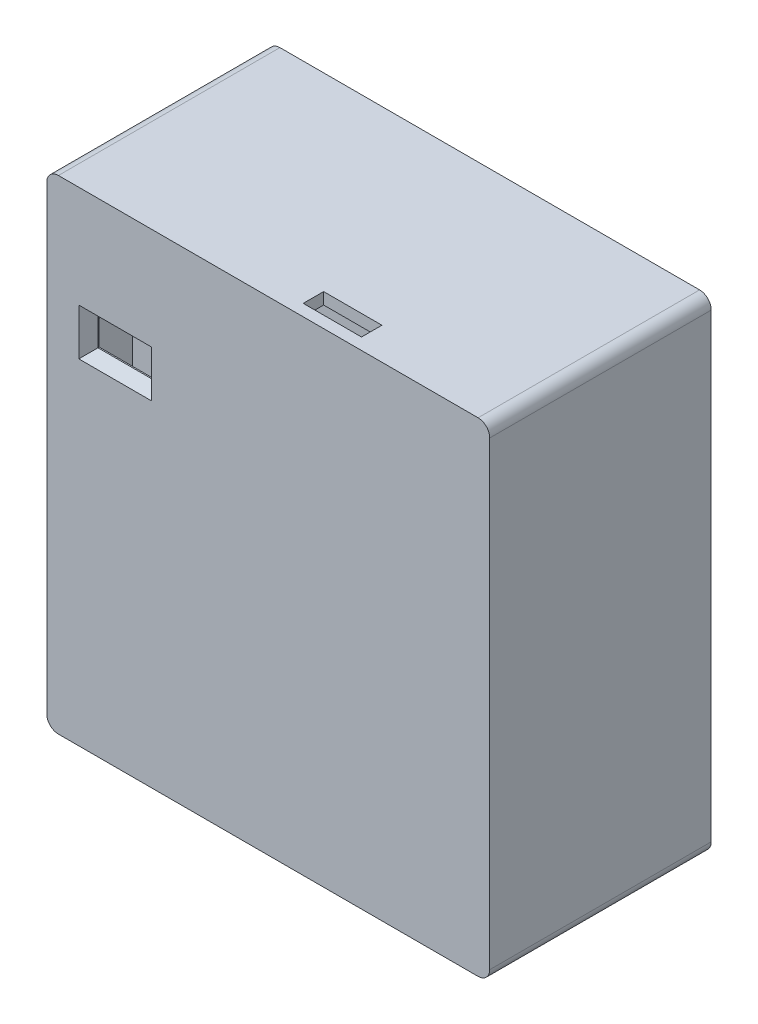
from build123d import *

# Parameters (mm, degrees)
BOSS_EXTRUDE2_DEPTH      = 39.5
BOSS_EXTRUDE2_DEPTH_BACK = 39.5
SKETCH1_W                = 76
SKETCH1_H                = 38
SKETCH1_W_2              = 72
SKETCH1_H_2              = 34
SKETCH2_W                = 76
SKETCH2_H                = 38
BOSS_EXTRUDE3_DEPTH      = 2
BOSS_EXTRUDE4_DEPTH      = 10
BOSS_EXTRUDE4_DEPTH_BACK = 10
SKETCH6_W                = 70
SKETCH6_H                = 70
FILLET1_R                = 2
CUT_EXTRUDE1_DEPTH       = 1
CUT_EXTRUDE1_DEPTH_BACK  = 2.5
SKETCH7_W                = 2
SKETCH7_H                = 10
SKETCH7_W_2              = 10
SKETCH7_H_2              = 2
SKETCH8_R                = 6.5
CUT_EXTRUDE2_DEPTH       = 2
SKETCH9_W                = 20
SKETCH9_H                = 7
SKETCH9_W_2              = 25
SKETCH9_W_3              = 7
SKETCH9_H_2              = 20
BOSS_EXTRUDE5_DEPTH      = 10
SKETCH10_W               = 9.5
SKETCH10_H               = 5
CUT_EXTRUDE3_DEPTH       = 2
CHAMFER1_SIZE            = 1.5
CHAMFER1_SIZE2           = 1.787630389
SKETCH11_W               = 3.7
SKETCH11_H               = 16
SKETCH11_R               = 1.25
SKETCH11_W_2             = 7
SKETCH11_H_2             = 5
BOSS_EXTRUDE10_DEPTH     = 7.3
CUT_EXTRUDE6_DEPTH       = 60.390655831
BOSS_EXTRUDE11_REACH     = 68.8
SKETCH17_R               = 2.75
CUT_EXTRUDE9_DEPTH       = 3


with BuildPart() as part:
    # Sketch1 → Boss-Extrude2 (new, two sides: drawn at the far end of the back side and taken through both)
    with BuildSketch(Plane(origin=(0, 0, 0), x_dir=(1, 0, 0), z_dir=(0, 1, 0)).offset(-BOSS_EXTRUDE2_DEPTH_BACK)):
        Rectangle(SKETCH1_W, SKETCH1_H)
        Rectangle(SKETCH1_W_2, SKETCH1_H_2, mode=Mode.SUBTRACT)
    extrude(amount=BOSS_EXTRUDE2_DEPTH + BOSS_EXTRUDE2_DEPTH_BACK)

    # Sketch2 → Boss-Extrude3 (add)
    with BuildSketch(Plane.XZ.offset(39.5)):
        Rectangle(SKETCH2_W, SKETCH2_H)
    boss_extrude3 = extrude(amount=BOSS_EXTRUDE3_DEPTH)

    # Mirror1: Boss-Extrude3 across plane
    add(boss_extrude3.mirror(Plane.ZX))

    # Fillet1
    fillet1_edges = [part.edges().sort_by_distance(p)[0] for p in [
        (38, -41.5, 0),
        (-38, -41.5, 0),
        (38, 41.5, 0),
        (-38, 41.5, 0),
    ]]
    fillet(fillet1_edges, radius=FILLET1_R)

    # Sketch7 → Cut-Extrude1 (cut, two sides: drawn at the far end of the back side and taken through both)
    with BuildSketch(Plane.XY.offset(16).offset(-CUT_EXTRUDE1_DEPTH_BACK)):
        with Locations((-37, -15.6)):
            Rectangle(SKETCH7_W, SKETCH7_H)
        with Locations((9, 40.5)):
            Rectangle(SKETCH7_W_2, SKETCH7_H_2)
    extrude(amount=CUT_EXTRUDE1_DEPTH + CUT_EXTRUDE1_DEPTH_BACK, mode=Mode.SUBTRACT)

    # Sketch8 → Cut-Extrude2 (cut)
    with BuildSketch(Plane.ZY.offset(38)):
        with Locations((-6.625, 8)):
            Circle(SKETCH8_R)
    extrude(amount=-CUT_EXTRUDE2_DEPTH, mode=Mode.SUBTRACT)

    # Sketch9 → Boss-Extrude5 (add)
    with BuildSketch(Plane.XY.offset(-17)):
        with Locations((-12.5, 21.25)):
            Rectangle(SKETCH9_W, SKETCH9_H)
        with Locations((-10, -26.25)):
            Rectangle(SKETCH9_W_2, SKETCH9_H)
        with Locations((8.5, -2.5)):
            Rectangle(SKETCH9_W_3, SKETCH9_H_2)
    extrude(amount=BOSS_EXTRUDE5_DEPTH)

    # Sketch10 → Cut-Extrude3 (cut)
    with BuildSketch(Plane.XY.offset(19)):
        with Locations((-26.25, 20)):
            Rectangle(SKETCH10_W, SKETCH10_H)
    extrude(amount=-CUT_EXTRUDE3_DEPTH, mode=Mode.SUBTRACT)

    # Chamfer1
    chamfer1_edges = [part.edges().sort_by_distance(p)[0] for p in [
        (-21.5, 20, 19),
        (-26.25, 22.5, 19),
        (-31, 20, 19),
        (-26.25, 17.5, 19),
    ]]
    chamfer1_side = [part.faces().sort_by_distance(p)[0] for p in [
        (0.199274696, -0.15182834, 19),
    ]]
    chamfer(chamfer1_edges, length=CHAMFER1_SIZE, length2=CHAMFER1_SIZE2, reference=chamfer1_side[0])

    # Sketch11 → Boss-Extrude10 (add)
    # profile 1 of 3: a face of its own
    with BuildSketch(Plane(origin=(0, 0, 17), x_dir=(-1, 0, 0), z_dir=(0, 0, -1))):
        with Locations((34.15, 12.5)):
            Rectangle(SKETCH11_W, SKETCH11_H)
        with Locations((33.85, 17.5)):
            Circle(SKETCH11_R, mode=Mode.SUBTRACT)
    # profile 2 of 3: a face of its own
    with BuildSketch(Plane(origin=(0, 0, 17), x_dir=(-1, 0, 0), z_dir=(0, 0, -1))):
        with Locations((-32.5, 17.5)):
            Rectangle(SKETCH11_W_2, SKETCH11_H_2)
        with Locations((-32.15, 17.5)):
            Circle(SKETCH11_R, mode=Mode.SUBTRACT)
    # profile 3 of 3: a face of its own
    with BuildSketch(Plane(origin=(0, 0, 17), x_dir=(-1, 0, 0), z_dir=(0, 0, -1))):
        with Locations((-32.5, -29)):
            Rectangle(SKETCH11_W_2, SKETCH11_H_2)
        with Locations((-32.15, -29)):
            Circle(SKETCH11_R, mode=Mode.SUBTRACT)
    extrude(amount=BOSS_EXTRUDE10_DEPTH)

    # Sketch15 → Cut-Extrude6 (cut, through all)
    with BuildSketch(Plane.XY):
        with BuildLine():
            Line((28.25, -22.25), (30.487468593, -22.25))
            ThreePointArc((30.487468593, -22.25), (29.767766953, -20.732233047), (28.25, -20.012531407))
            Line((28.25, -20.012531407), (28.25, -22.25))
        make_face()
        with BuildLine():
            Line((25.512531407, -22.25), (27.75, -22.25))
            Line((27.75, -22.25), (27.75, -20.012531407))
            ThreePointArc((27.75, -20.012531407), (26.232233047, -20.732233047), (25.512531407, -22.25))
        make_face()
        with BuildLine():
            Line((27.75, -24.987468593), (27.75, -22.75))
            Line((27.75, -22.75), (25.512531407, -22.75))
            ThreePointArc((25.512531407, -22.75), (26.232233047, -24.267766953), (27.75, -24.987468593))
        make_face()
        with BuildLine():
            Line((30.487468593, -22.75), (28.25, -22.75))
            Line((28.25, -22.75), (28.25, -24.987468593))
            ThreePointArc((28.25, -24.987468593), (29.767766953, -24.267766953), (30.487468593, -22.75))
        make_face()
    extrude(amount=-CUT_EXTRUDE6_DEPTH, mode=Mode.SUBTRACT)

    # Sketch16 → Boss-Extrude11 (add, up to next)
    with BuildSketch(Plane(origin=(0, 0, 17), x_dir=(-1, 0, 0), z_dir=(0, 0, -1)), mode=Mode.PRIVATE) as boss_extrude11_sk1:
        with BuildLine():
            Line((-36, 35.600123765), (-36, 32.684136008))
            Line((-36, 32.684136008), (-32.592068004, 36.092068004))
            ThreePointArc((-32.592068004, 36.092068004), (-34.214243489, 35.279494054), (-36, 35.600123765))
        make_face()
    boss_extrude11_tool1 = extrude(boss_extrude11_sk1.sketch, amount=BOSS_EXTRUDE11_REACH, mode=Mode.PRIVATE) - part.part
    # Sketch16 → Boss-Extrude11 (add, up to next)
    with BuildSketch(Plane(origin=(0, 0, 17), x_dir=(-1, 0, 0), z_dir=(0, 0, -1)), mode=Mode.PRIVATE) as boss_extrude11_sk2:
        with BuildLine():
            ThreePointArc((-36, 35.600123765), (-34.214243489, 35.279494054), (-32.592068004, 36.092068004))
            ThreePointArc((-32.592068004, 36.092068004), (-31.968846344, 37.024785132), (-31.75, 38.125))
            ThreePointArc((-31.75, 38.125), (-31.838905585, 38.834438449), (-32.100123765, 39.5))
            Line((-32.100123765, 39.5), (-34.625, 39.5))
            ThreePointArc((-34.625, 39.5), (-33.652728176, 39.097271824), (-33.25, 38.125))
            ThreePointArc((-33.25, 38.125), (-34.625, 36.75), (-36, 38.125))
            Line((-36, 38.125), (-36, 35.600123765))
        make_face()
    boss_extrude11_tool2 = extrude(boss_extrude11_sk2.sketch, amount=BOSS_EXTRUDE11_REACH, mode=Mode.PRIVATE) - part.part
    # Sketch16 → Boss-Extrude11 (add, up to next)
    with BuildSketch(Plane(origin=(0, 0, 17), x_dir=(-1, 0, 0), z_dir=(0, 0, -1)), mode=Mode.PRIVATE) as boss_extrude11_sk3:
        with BuildLine():
            ThreePointArc((-31.75, 38.125), (-31.968846344, 37.024785132), (-32.592068004, 36.092068004))
            Line((-32.592068004, 36.092068004), (-29.184136008, 39.5))
            Line((-29.184136008, 39.5), (-32.100123765, 39.5))
            ThreePointArc((-32.100123765, 39.5), (-31.838905585, 38.834438449), (-31.75, 38.125))
        make_face()
    boss_extrude11_tool3 = extrude(boss_extrude11_sk3.sketch, amount=BOSS_EXTRUDE11_REACH, mode=Mode.PRIVATE) - part.part
    # Sketch16 → Boss-Extrude11 (add, up to next)
    with BuildSketch(Plane(origin=(0, 0, 17), x_dir=(-1, 0, 0), z_dir=(0, 0, -1)), mode=Mode.PRIVATE) as boss_extrude11_sk4:
        with BuildLine():
            Line((-36, 39.5), (-36, 38.125))
            ThreePointArc((-36, 38.125), (-35.597271824, 39.097271824), (-34.625, 39.5))
            Line((-34.625, 39.5), (-36, 39.5))
        make_face()
    boss_extrude11_tool4 = extrude(boss_extrude11_sk4.sketch, amount=BOSS_EXTRUDE11_REACH, mode=Mode.PRIVATE) - part.part
    # Sketch16 → Boss-Extrude11 (add, up to next)
    with BuildSketch(Plane(origin=(0, 0, 17), x_dir=(-1, 0, 0), z_dir=(0, 0, -1)), mode=Mode.PRIVATE) as boss_extrude11_sk5:
        with BuildLine():
            ThreePointArc((36, -38.125), (35.597271824, -39.097271824), (34.625, -39.5))
            Line((34.625, -39.5), (36, -39.5))
            Line((36, -39.5), (36, -38.125))
        make_face()
    boss_extrude11_tool5 = extrude(boss_extrude11_sk5.sketch, amount=BOSS_EXTRUDE11_REACH, mode=Mode.PRIVATE) - part.part
    # Sketch16 → Boss-Extrude11 (add, up to next)
    with BuildSketch(Plane(origin=(0, 0, 17), x_dir=(-1, 0, 0), z_dir=(0, 0, -1)), mode=Mode.PRIVATE) as boss_extrude11_sk6:
        with BuildLine():
            ThreePointArc((36, -35.600123765), (34.214243489, -35.279494054), (32.592068004, -36.092068004))
            ThreePointArc((32.592068004, -36.092068004), (31.779494054, -37.714243489), (32.100123765, -39.5))
            Line((32.100123765, -39.5), (34.625, -39.5))
            ThreePointArc((34.625, -39.5), (33.652728176, -37.152728176), (36, -38.125))
            Line((36, -38.125), (36, -35.600123765))
        make_face()
    boss_extrude11_tool6 = extrude(boss_extrude11_sk6.sketch, amount=BOSS_EXTRUDE11_REACH, mode=Mode.PRIVATE) - part.part
    # Sketch16 → Boss-Extrude11 (add, up to next)
    with BuildSketch(Plane(origin=(0, 0, 17), x_dir=(-1, 0, 0), z_dir=(0, 0, -1)), mode=Mode.PRIVATE) as boss_extrude11_sk7:
        with BuildLine():
            Line((36, -32.684136008), (32.592068004, -36.092068004))
            ThreePointArc((32.592068004, -36.092068004), (34.214243489, -35.279494054), (36, -35.600123765))
            Line((36, -35.600123765), (36, -32.684136008))
        make_face()
    boss_extrude11_tool7 = extrude(boss_extrude11_sk7.sketch, amount=BOSS_EXTRUDE11_REACH, mode=Mode.PRIVATE) - part.part
    # Sketch16 → Boss-Extrude11 (add, up to next)
    with BuildSketch(Plane(origin=(0, 0, 17), x_dir=(-1, 0, 0), z_dir=(0, 0, -1)), mode=Mode.PRIVATE) as boss_extrude11_sk8:
        with BuildLine():
            Line((32.592068004, -36.092068004), (29.184136008, -39.5))
            Line((29.184136008, -39.5), (32.100123765, -39.5))
            ThreePointArc((32.100123765, -39.5), (31.779494054, -37.714243489), (32.592068004, -36.092068004))
        make_face()
    boss_extrude11_tool8 = extrude(boss_extrude11_sk8.sketch, amount=BOSS_EXTRUDE11_REACH, mode=Mode.PRIVATE) - part.part
    add(boss_extrude11_tool1.solids().sort_by_distance((35.086577, 34.486498, 17))[0])
    add(boss_extrude11_tool2.solids().sort_by_distance((33.6128, 37.1128, 17))[0])
    add(boss_extrude11_tool3.solids().sort_by_distance((30.986498, 38.586577, 17))[0])
    add(boss_extrude11_tool4.solids().sort_by_distance((35.692869, 39.192869, 17))[0])
    add(boss_extrude11_tool5.solids().sort_by_distance((-35.692869, -39.192869, 17))[0])
    add(boss_extrude11_tool6.solids().sort_by_distance((-33.6128, -37.1128, 17))[0])
    add(boss_extrude11_tool7.solids().sort_by_distance((-35.086577, -34.486498, 17))[0])
    add(boss_extrude11_tool8.solids().sort_by_distance((-30.986498, -38.586577, 17))[0])

    # Sketch17 → Cut-Extrude9 (cut)
    with BuildSketch(Plane(origin=(0, 0, -19), x_dir=(-1, 0, 0), z_dir=(0, 0, -1))):
        with Locations((-34.625, 38.125)):
            Circle(SKETCH17_R)
        with Locations((34.625, -38.125)):
            Circle(SKETCH17_R)
    extrude(amount=-CUT_EXTRUDE9_DEPTH, mode=Mode.SUBTRACT)


with BuildPart() as body_2:
    # Sketch6 → Boss-Extrude4 (new, two sides: drawn at the far end of the back side and taken through both)
    with BuildSketch(Plane.XY.offset(-BOSS_EXTRUDE4_DEPTH_BACK)):
        with Locations((0, 3.5)):
            Rectangle(SKETCH6_W, SKETCH6_H)
    extrude(amount=BOSS_EXTRUDE4_DEPTH + BOSS_EXTRUDE4_DEPTH_BACK)


solid = Compound([part.part, body_2.part])
